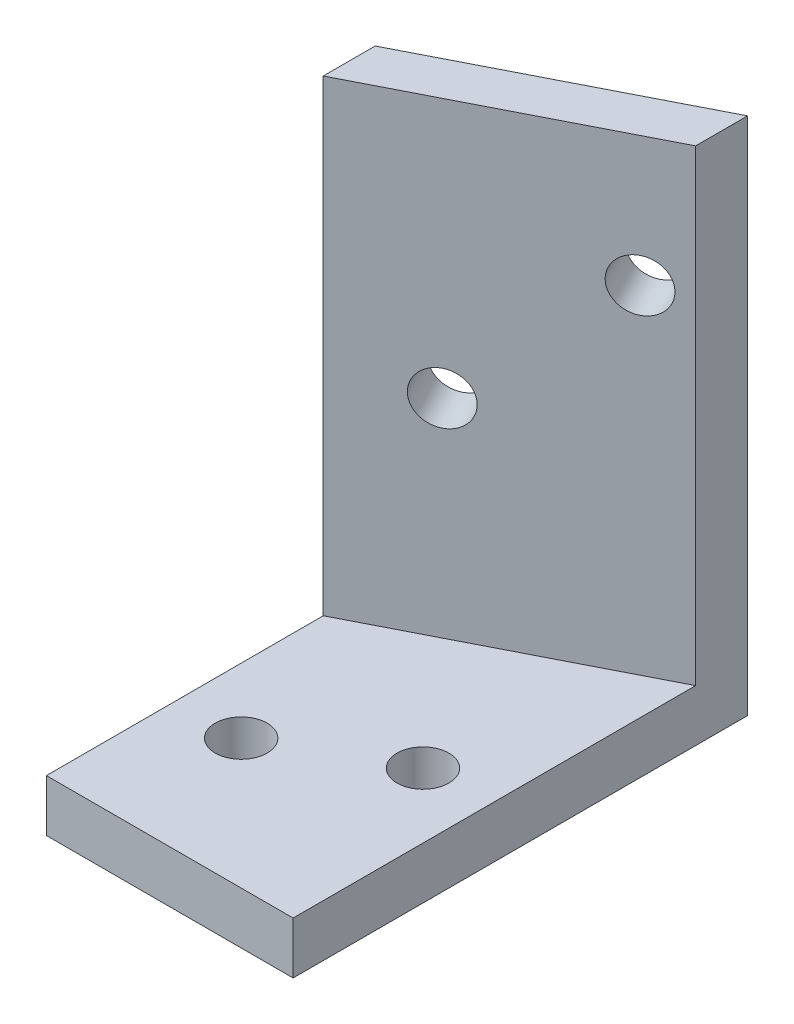
from build123d import *

# Parameters (mm, degrees)
SKETCH1_W           = 19
SKETCH1_H           = 35
BOSS_EXTRUDE1_DEPTH = 4
CUT_EXTRUDE1_DEPTH  = 21.310096012
BOSS_EXTRUDE2_DEPTH = 36
SKETCH4_R           = 2
CUT_EXTRUDE2_DEPTH  = 51.72266342
SKETCH5_R           = 2
CUT_EXTRUDE3_DEPTH  = 42.140004861


with BuildPart() as part:
    # Sketch1 → Boss-Extrude1 (new body)
    with BuildSketch(Plane(origin=(0, 0, 0), x_dir=(1, 0, 0), z_dir=(0, 1, 0))):
        Rectangle(SKETCH1_W, SKETCH1_H)
    extrude(amount=BOSS_EXTRUDE1_DEPTH)

    # Sketch2 → Cut-Extrude1 (cut, through all)
    with BuildSketch(Plane(origin=(0, 4, 0), x_dir=(1, 0, 0), z_dir=(0, 1, 0))):
        Polygon((9.5, 17.5), (-9.5, 7.81901646), (-9.5, 17.5), align=None)
    extrude(amount=-CUT_EXTRUDE1_DEPTH, mode=Mode.SUBTRACT)

    # Sketch3 → Boss-Extrude2 (add)
    with BuildSketch(Plane(origin=(0, 4, 0), x_dir=(1, 0, 0), z_dir=(0, 1, 0))):
        Polygon((9.5, 17.5), (-9.5, 7.81901646), (-9.5, 3.81901646), (9.5, 13.5), align=None)
    extrude(amount=BOSS_EXTRUDE2_DEPTH)

    # Sketch4 → Cut-Extrude2 (cut, through all)
    with BuildSketch(Plane(origin=(-5.120878649, 0, -10.050290234), x_dir=(-0.8910065241883689, 0, 0.45399049973954486), z_dir=(-0.4539904997395449, 0, -0.891006524188369))):
        with Locations((-11.409395725, 30)):
            Circle(SKETCH4_R)
        with Locations((-0.08519721, 20)):
            Circle(SKETCH4_R)
    extrude(amount=-CUT_EXTRUDE2_DEPTH, mode=Mode.SUBTRACT)

    # Sketch5 → Cut-Extrude3 (cut, through all)
    with BuildSketch(Plane(origin=(0, 4, 0), x_dir=(1, 0, 0), z_dir=(0, 1, 0))):
        with Locations(Location((-4.5, -7.5, 0), (0, 0, 270))):
            Circle(SKETCH5_R)
        with Locations(Location((4.5, -2.5, 0), (0, 0, 270))):
            Circle(SKETCH5_R)
    extrude(amount=-CUT_EXTRUDE3_DEPTH, mode=Mode.SUBTRACT)


solid = part.part
